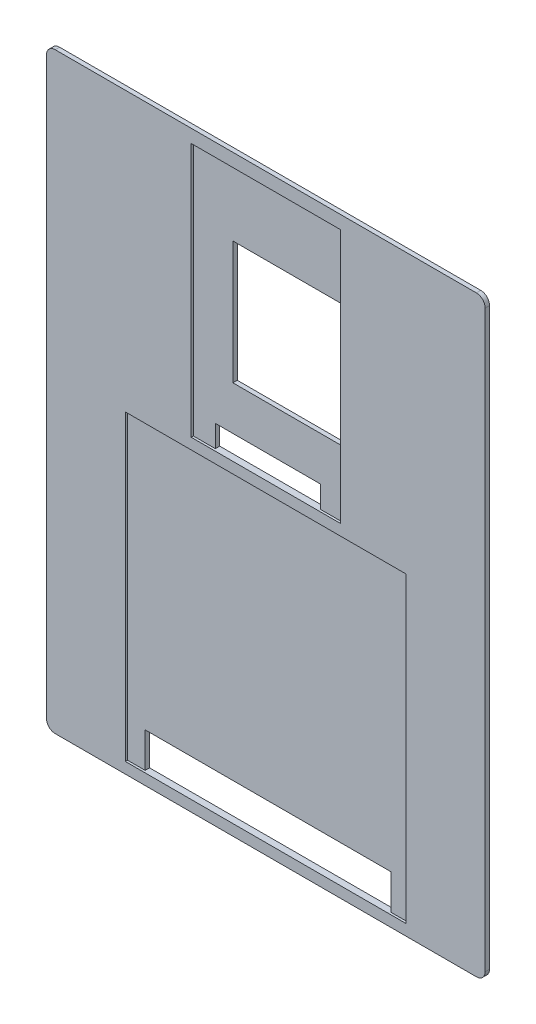
from build123d import *

# Parameters (mm, degrees)
BOSS_EXTRUDE2_DEPTH = 1.5
BOSS_EXTRUDE3_DEPTH = 1
FILLET1_R           = 2
CUT_EXTRUDE1_START  = -0.5
SKETCH2_W           = 98
SKETCH2_H           = 133
CUT_EXTRUDE1_DEPTH  = 0.5
FILLET2_R           = 2


with BuildPart() as part:
    # Sketch1 → Boss-Extrude2 (new body)
    with BuildSketch(Plane.XY):
        Polygon((-50, -67.5), (0, -67.5), (50, -67.5), (50, 67.5), (0, 67.5), (-50, 67.5), align=None)
        Polygon((28, -65), (0, -65), (-28, -65), (-32, -65), (-32, 4), (32, 4), (32, -65), align=None, mode=Mode.SUBTRACT)
        Polygon((-17, 64.5), (0, 64.5), (17, 64.5), (17, 49.5), (17, 21.5), (17, 6.5), (12, 6.5), (0, 6.5), (-12, 6.5), (-17, 6.5), align=None, mode=Mode.SUBTRACT)
    extrude(amount=BOSS_EXTRUDE2_DEPTH)

    # Sketch1<5> → Boss-Extrude3 (add)
    with BuildSketch(Plane.XY):
        Polygon((17, 64.5), (-17, 64.5), (-17, 6.5), (-12, 6.5), (-12, 11.5), (12, 11.5), (12, 6.5), (17, 6.5), (17, 21.5), (-8, 21.5), (-8, 49.5), (17, 49.5), align=None)
        Polygon((-28, -57), (0, -57), (28, -57), (28, -65), (32, -65), (32, 4), (-32, 4), (-32, -65), (-28, -65), align=None)
    extrude(amount=BOSS_EXTRUDE3_DEPTH)

    # Fillet1
    fillet1_edges = [part.edges().sort_by_distance(p)[0] for p in [
        (50, 67.5, 0.75),
        (-50, 67.5, 0.75),
        (50, -67.5, 0.75),
        (-50, -67.5, 0.75),
    ]]
    fillet(fillet1_edges, radius=FILLET1_R)

    # Sketch2 → Cut-Extrude1 (cut)
    with BuildSketch(Plane(origin=(0, 0, 0), x_dir=(-1, 0, 0), z_dir=(0, 0, -1)).offset(CUT_EXTRUDE1_START)):
        with BuildLine():
            Line((-48, -67.5), (48, -67.5))
            ThreePointArc((48, -67.5), (49.414213562, -66.914213562), (50, -65.5))
            Line((50, -65.5), (50, 65.5))
            ThreePointArc((50, 65.5), (49.414213562, 66.914213562), (48, 67.5))
            Line((48, 67.5), (-48, 67.5))
            ThreePointArc((-48, 67.5), (-49.414213562, 66.914213562), (-50, 65.5))
            Line((-50, 65.5), (-50, -65.5))
            ThreePointArc((-50, -65.5), (-49.414213562, -66.914213562), (-48, -67.5))
        make_face()
        Rectangle(SKETCH2_W, SKETCH2_H, mode=Mode.SUBTRACT)
    extrude(amount=CUT_EXTRUDE1_DEPTH, mode=Mode.SUBTRACT)

    # Fillet2
    fillet2_edges = [part.edges().sort_by_distance(p)[0] for p in [
        (49, -66.5, 0.25),
        (-49, -66.5, 0.25),
        (-49, 66.5, 0.25),
        (49, 66.5, 0.25),
    ]]
    fillet(fillet2_edges, radius=FILLET2_R)


solid = part.part
